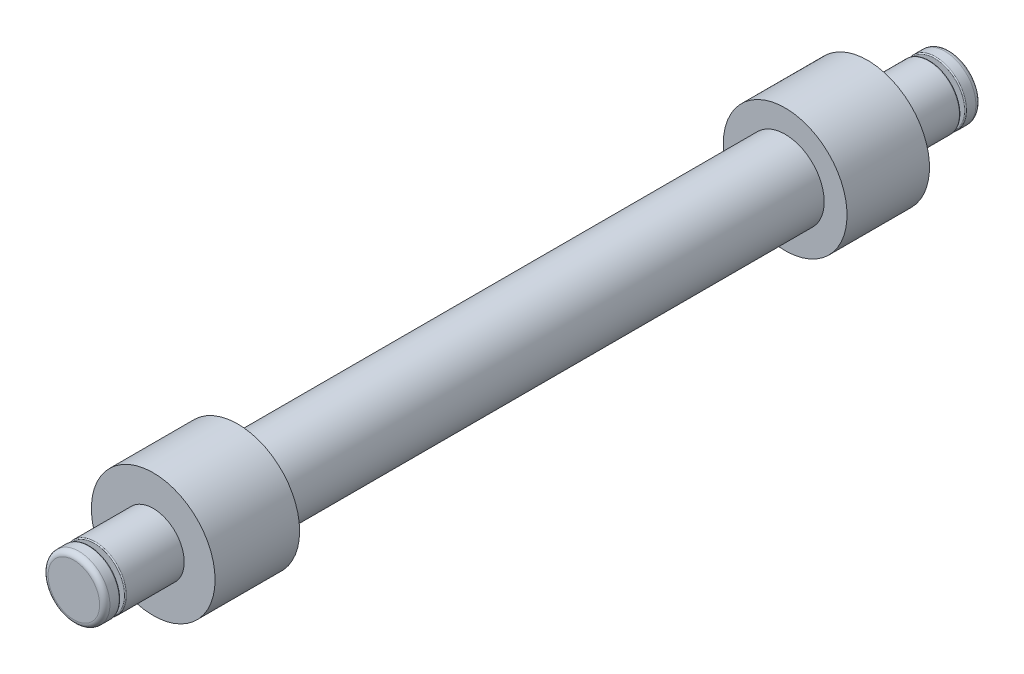
from build123d import *

# Parameters (mm, degrees)
SKETCH1_R                = 3.784872219
BOSS_EXTRUDE1_DEPTH      = 55.1
BOSS_EXTRUDE2_DEPTH      = 6.2
BOSS_EXTRUDE2_DEPTH_BACK = 2
SKETCH2_R                = 6
SKETCH3_R                = 6
BOSS_EXTRUDE3_DEPTH      = 8
BOSS_EXTRUDE4_DEPTH      = 6
BOSS_EXTRUDE4_DEPTH_BACK = 75
SKETCH4_R                = 3.003880852
BOSS_EXTRUDE5_DEPTH      = 0.5
BOSS_EXTRUDE5_DEPTH_BACK = 81.5
SKETCH5_R                = 1.75
SKETCH6_R                = 3.003880852
BOSS_EXTRUDE6_DEPTH      = 1.5
SKETCH7_R                = 3
BOSS_EXTRUDE7_DEPTH      = 1.5
FILLET1_R                = 0.5
FILLET2_R                = 0.1


with BuildPart() as part:
    # Sketch1 → Boss-Extrude1 (new body)
    with BuildSketch(Plane.XY):
        with Locations((-146.151339286, 83.763457126)):
            Circle(SKETCH1_R)
    extrude(amount=-BOSS_EXTRUDE1_DEPTH)

    # Sketch2 → Boss-Extrude2 (add, two sides: drawn at the far end of the back side and taken through both)
    with BuildSketch(Plane.XY.offset(-BOSS_EXTRUDE2_DEPTH_BACK)):
        with Locations((-146.151339286, 83.763457126)):
            Circle(SKETCH2_R)
    extrude(amount=BOSS_EXTRUDE2_DEPTH + BOSS_EXTRUDE2_DEPTH_BACK)

    # Sketch3 → Boss-Extrude3 (add)
    with BuildSketch(Plane(origin=(0, 0, -55.1), x_dir=(-1, 0, 0), z_dir=(0, 0, -1))):
        with Locations(Location((146.151339286, 83.763457126, 0), (0, 0, 180))):
            Circle(SKETCH3_R)
    extrude(amount=BOSS_EXTRUDE3_DEPTH)

    # Sketch4 → Boss-Extrude4 (add, two sides: drawn at the far end of the back side and taken through both)
    with BuildSketch(Plane(origin=(0, 0, -63.1), x_dir=(-1, 0, 0), z_dir=(0, 0, -1)).offset(-BOSS_EXTRUDE4_DEPTH_BACK)):
        with Locations((146.151339286, 83.763457126)):
            Circle(SKETCH4_R)
    extrude(amount=BOSS_EXTRUDE4_DEPTH + BOSS_EXTRUDE4_DEPTH_BACK)

    # Sketch5 → Boss-Extrude5 (add, two sides: drawn at the far end of the back side and taken through both)
    with BuildSketch(Plane(origin=(0, 0, -69.1), x_dir=(-1, 0, 0), z_dir=(0, 0, -1)).offset(-BOSS_EXTRUDE5_DEPTH_BACK)):
        with Locations((146.151339286, 83.763457126)):
            Circle(SKETCH5_R)
    extrude(amount=BOSS_EXTRUDE5_DEPTH + BOSS_EXTRUDE5_DEPTH_BACK)

    # Sketch6 → Boss-Extrude6 (add)
    with BuildSketch(Plane(origin=(0, 0, -69.6), x_dir=(-1, 0, 0), z_dir=(0, 0, -1))):
        with Locations((146.151339286, 83.763457126)):
            Circle(SKETCH6_R)
    extrude(amount=BOSS_EXTRUDE6_DEPTH)

    # Sketch7 → Boss-Extrude7 (add)
    with BuildSketch(Plane.XY.offset(12.4)):
        with Locations((-146.151339286, 83.763457126)):
            Circle(SKETCH7_R)
    extrude(amount=BOSS_EXTRUDE7_DEPTH)

    # Fillet1
    fillet1_edges = [part.edges().sort_by_distance(p)[0] for p in [
        (-143.147458434, 83.763457126, -71.1),
        (-149.151339286, 83.763457126, 13.9),
    ]]
    fillet(fillet1_edges, radius=FILLET1_R)

    # Fillet2
    fillet2_edges = [part.edges().sort_by_distance(p)[0] for p in [
        (-143.147458434, 83.763457126, 11.9),
        (-143.147458434, 83.763457126, -69.1),
        (-143.147458434, 83.763457126, -69.6),
        (-149.151339286, 83.763457126, 12.4),
    ]]
    fillet(fillet2_edges, radius=FILLET2_R)


solid = part.part
